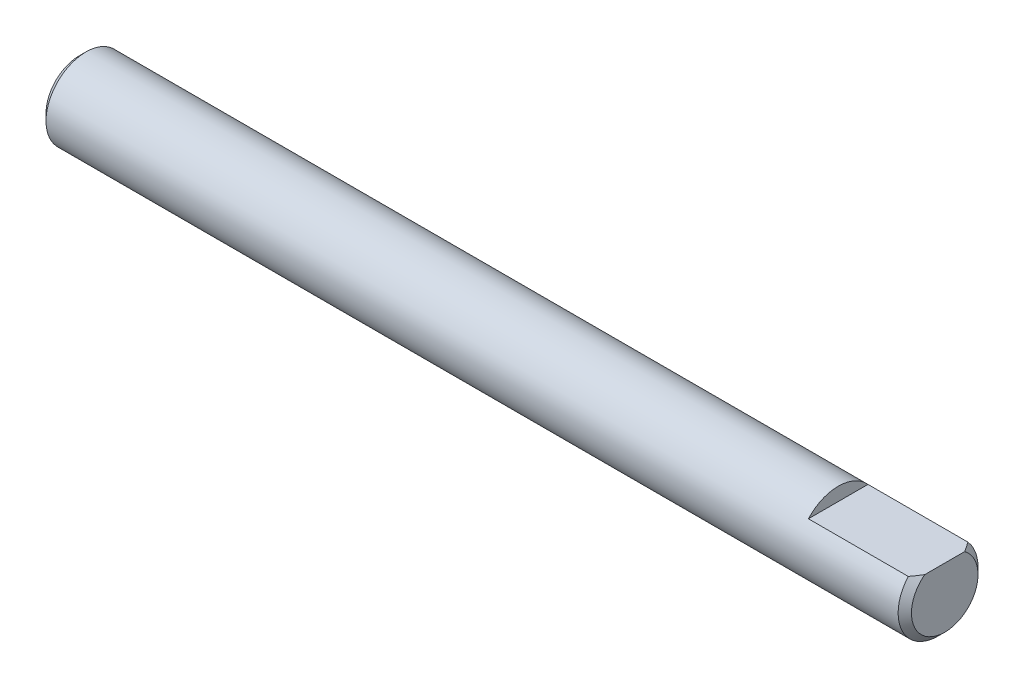
from build123d import *

# Parameters (mm, degrees)
SKETCH1_R           = 3
BOSS_EXTRUDE1_DEPTH = 32.5
CHAMFER1_SIZE       = 0.5
CUT_EXTRUDE1_DEPTH  = 8


with BuildPart() as part:
    # Sketch1 → Boss-Extrude1 (new, symmetric)
    with BuildSketch(Plane(origin=(0, 0, 0), x_dir=(0, 0, -1), z_dir=(1, 0, 0))):
        Circle(SKETCH1_R)
    extrude(amount=BOSS_EXTRUDE1_DEPTH, both=True)

    # Chamfer1
    chamfer1_edges = [part.edges().sort_by_distance(p)[0] for p in [
        (-32.5, 0, 3),
        (32.5, 0, 3),
    ]]
    chamfer(chamfer1_edges, length=CHAMFER1_SIZE)

    # Sketch2 → Cut-Extrude1 (cut)
    with BuildSketch(Plane(origin=(32.5, 0, 0), x_dir=(0, 0, -1), z_dir=(1, 0, 0))):
        with BuildLine():
            Line((-2.236067977, 2), (2.236067977, 2))
            ThreePointArc((2.236067977, 2), (0, 3), (-2.236067977, 2))
        make_face()
    extrude(amount=-CUT_EXTRUDE1_DEPTH, mode=Mode.SUBTRACT)


solid = part.part
